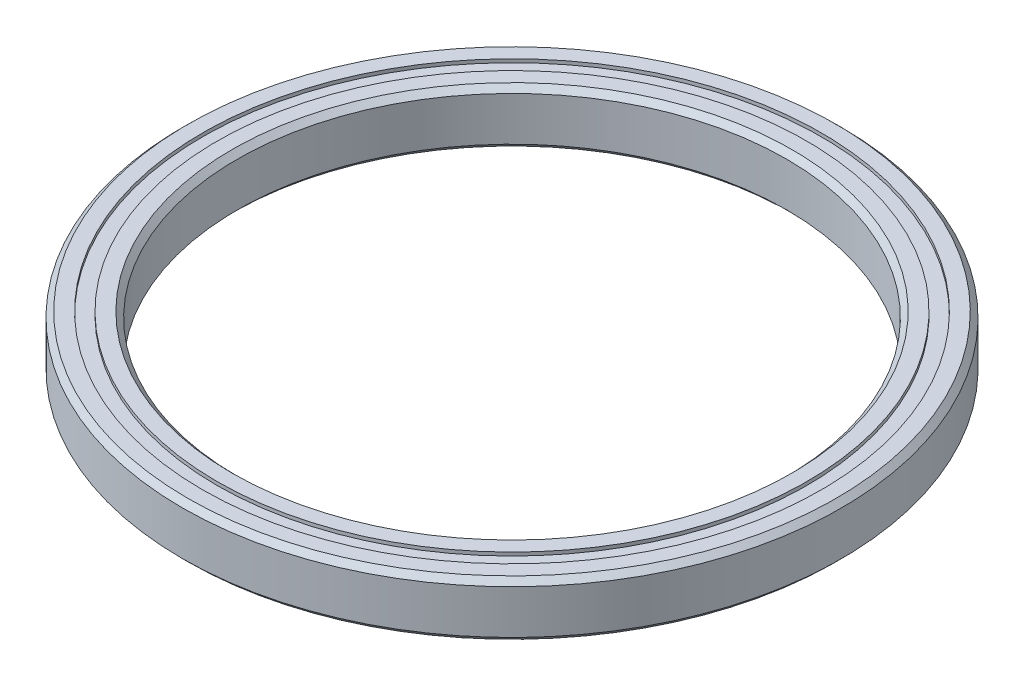
from build123d import *

# Parameters (mm, degrees)
SKETCH_1_R          = 48
SKETCH_1_R_2        = 40
EXTRUDE_1_DEPTH     = 8
SKETCH_2_R          = 45.05
SKETCH_2_R_2        = 42.95
CUT_EXTRUDE_1_DEPTH = 0.5
CUT_EXTRUDE_START   = -7.5
SKETCH_2_2_R        = 45.05
SKETCH_2_2_R_2      = 42.95
CUT_EXTRUDE_2_DEPTH = 0.5
CHAMFER_1_SIZE      = 0.8


with BuildPart() as part:
    # 草图1 → 凸台-拉伸1 (new body)
    with BuildSketch(Plane(origin=(0, 0, 0), x_dir=(1, 0, 0), z_dir=(0, 1, 0))):
        with Locations(Location((0, 0, 0), (0, 0, 270))):
            Circle(SKETCH_1_R)
        with Locations(Location((0, 0, 0), (0, 0, 270))):
            Circle(SKETCH_1_R_2, mode=Mode.SUBTRACT)
    extrude(amount=EXTRUDE_1_DEPTH)

    # 草图2 → 切除-拉伸1 (cut)
    with BuildSketch(Plane(origin=(0, 8, 0), x_dir=(1, 0, 0), z_dir=(0, 1, 0))):
        with Locations(Location((0, 0, 0), (0, 0, 270))):
            Circle(SKETCH_2_R)
        with Locations(Location((0, 0, 0), (0, 0, 270))):
            Circle(SKETCH_2_R_2, mode=Mode.SUBTRACT)
    extrude(amount=-CUT_EXTRUDE_1_DEPTH, mode=Mode.SUBTRACT)

    # 草图2<2> → 切除-拉伸2 (cut)
    with BuildSketch(Plane(origin=(0, 8, 0), x_dir=(1, 0, 0), z_dir=(0, 1, 0)).offset(CUT_EXTRUDE_START)):
        with Locations(Location((0, 0, 0), (0, 0, 270))):
            Circle(SKETCH_2_2_R)
        with Locations(Location((0, 0, 0), (0, 0, 270))):
            Circle(SKETCH_2_2_R_2, mode=Mode.SUBTRACT)
    extrude(amount=-CUT_EXTRUDE_2_DEPTH, mode=Mode.SUBTRACT)

    # 倒角1
    chamfer_1_edges = [part.edges().sort_by_distance(p)[0] for p in [
        (0, 0, -48),
        (0, 8, -48),
        (0, 0, -40),
        (0, 8, -40),
    ]]
    chamfer(chamfer_1_edges, length=CHAMFER_1_SIZE)


solid = part.part
